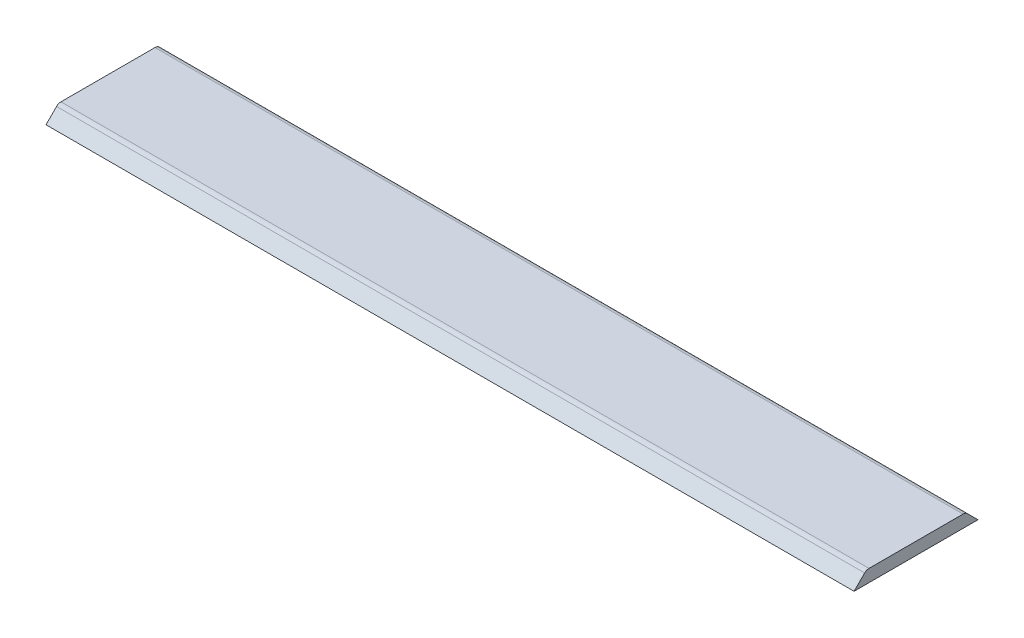
from build123d import *

# Parameters (mm, degrees)
EXTRUDE_1_DEPTH = 32600
FILLET_1_R      = 250


with BuildPart() as part:
    # 草图1 → 凸台-拉伸1 (new body)
    with BuildSketch(Plane(origin=(0, 0, 0), x_dir=(0, 0, -1), z_dir=(1, 0, 0))):
        Polygon((0, 0), (5000, 0), (4500, 500), (500, 500), align=None)
    extrude(amount=EXTRUDE_1_DEPTH)

    # 圆角1
    fillet_1_edges = [part.edges().sort_by_distance(p)[0] for p in [
        (16300, 500, -500),
        (16300, 500, -4500),
    ]]
    fillet(fillet_1_edges, radius=FILLET_1_R)


solid = part.part
